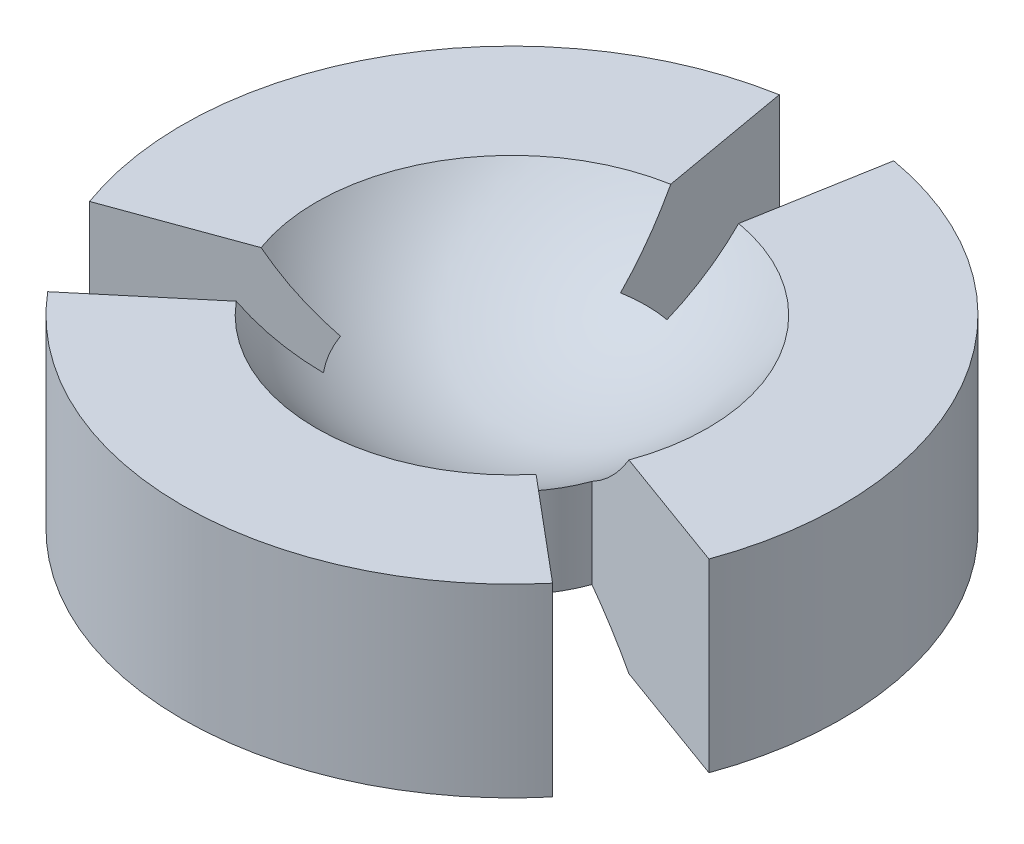
from build123d import *

# Parameters (mm, degrees)
CUT_EXTRUDE_1_DEPTH = 8.494436886


with BuildPart() as part:
    # 草图1 → 旋转2 (revolve)
    with BuildSketch(Plane.XY):
        with BuildLine():
            Line((-2.925029572, 5.6), (-4.925029572, 5.6))
            Line((-4.925029572, 5.6), (-4.925029572, 8.366722189))
            Line((-4.925029572, 8.366722189), (-2.925029572, 8.366722189))
            ThreePointArc((-2.925029572, 8.366722189), (-1.636083126, 7.287220203), (0, 6.9))
            Line((0, 6.9), (0, 6.6))
            ThreePointArc((0, 6.6), (-1.54562269, 6.343093076), (-2.925029572, 5.6))
        make_face()
    revolve(axis=Axis((0, 6.9, 0), (0, -1, 0)))

    # 草图2 → 切除-拉伸1 (cut, through all)
    with BuildSketch(Plane(origin=(0, 8.366722189, 0), x_dir=(1, 0, 0), z_dir=(0, 1, 0))):
        with BuildLine():
            Line((-0.347296355, 1.969615506), (-1.736481777, 9.84807753))
            ThreePointArc((-1.736481777, 9.84807753), (0, 10), (1.736481777, 9.84807753))
            Line((1.736481777, 9.84807753), (0.347296355, 1.969615506))
            ThreePointArc((0.347296355, 1.969615506), (0, 2), (-0.347296355, 1.969615506))
        make_face()
        with BuildLine():
            Line((1.879385242, -0.684040287), (9.396926208, -3.420201433))
            ThreePointArc((9.396926208, -3.420201433), (8.660254038, -5), (7.660444431, -6.427876097))
            Line((7.660444431, -6.427876097), (1.532088886, -1.285575219))
            ThreePointArc((1.532088886, -1.285575219), (1.732050808, -1), (1.879385242, -0.684040287))
        make_face()
        with BuildLine():
            Line((-1.532088886, -1.285575219), (-7.660444431, -6.427876097))
            ThreePointArc((-7.660444431, -6.427876097), (-8.660254038, -5), (-9.396926208, -3.420201433))
            Line((-9.396926208, -3.420201433), (-1.879385242, -0.684040287))
            ThreePointArc((-1.879385242, -0.684040287), (-1.732050808, -1), (-1.532088886, -1.285575219))
        make_face()
    extrude(amount=-CUT_EXTRUDE_1_DEPTH, mode=Mode.SUBTRACT)


solid = part.part
